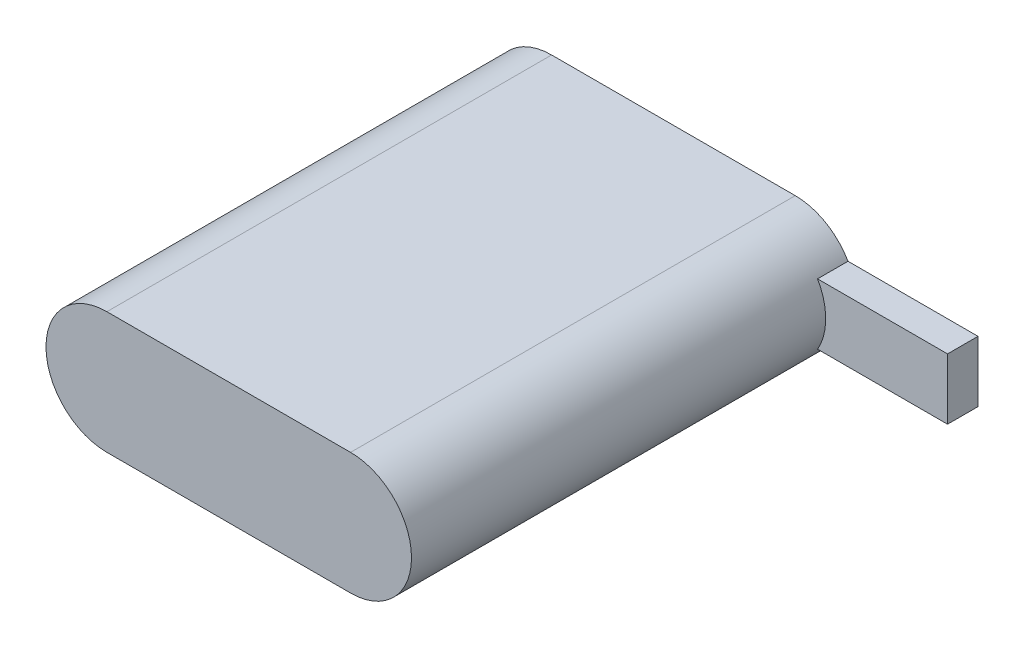
from build123d import *

# Parameters (mm, degrees)
BOSS_EXTRUDE1_DEPTH = 73
SKETCH2_W           = 5
SKETCH2_H           = 10
BOSS_EXTRUDE2_DEPTH = 50


with BuildPart() as part:
    # Sketch1 → Boss-Extrude1 (new body)
    with BuildSketch(Plane.XY):
        with BuildLine():
            Line((-20, -10), (20, -10))
            ThreePointArc((20, -10), (30, 0), (20, 10))
            Line((20, 10), (-20, 10))
            ThreePointArc((-20, 10), (-30, 0), (-20, -10))
        make_face()
    extrude(amount=BOSS_EXTRUDE1_DEPTH)

    # Sketch2 → Boss-Extrude2 (add)
    with BuildSketch(Plane(origin=(0, 0, 0), x_dir=(0, 0, -1), z_dir=(1, 0, 0))):
        with Locations((-2.5, 0)):
            Rectangle(SKETCH2_W, SKETCH2_H)
    extrude(amount=BOSS_EXTRUDE2_DEPTH)


solid = part.part
